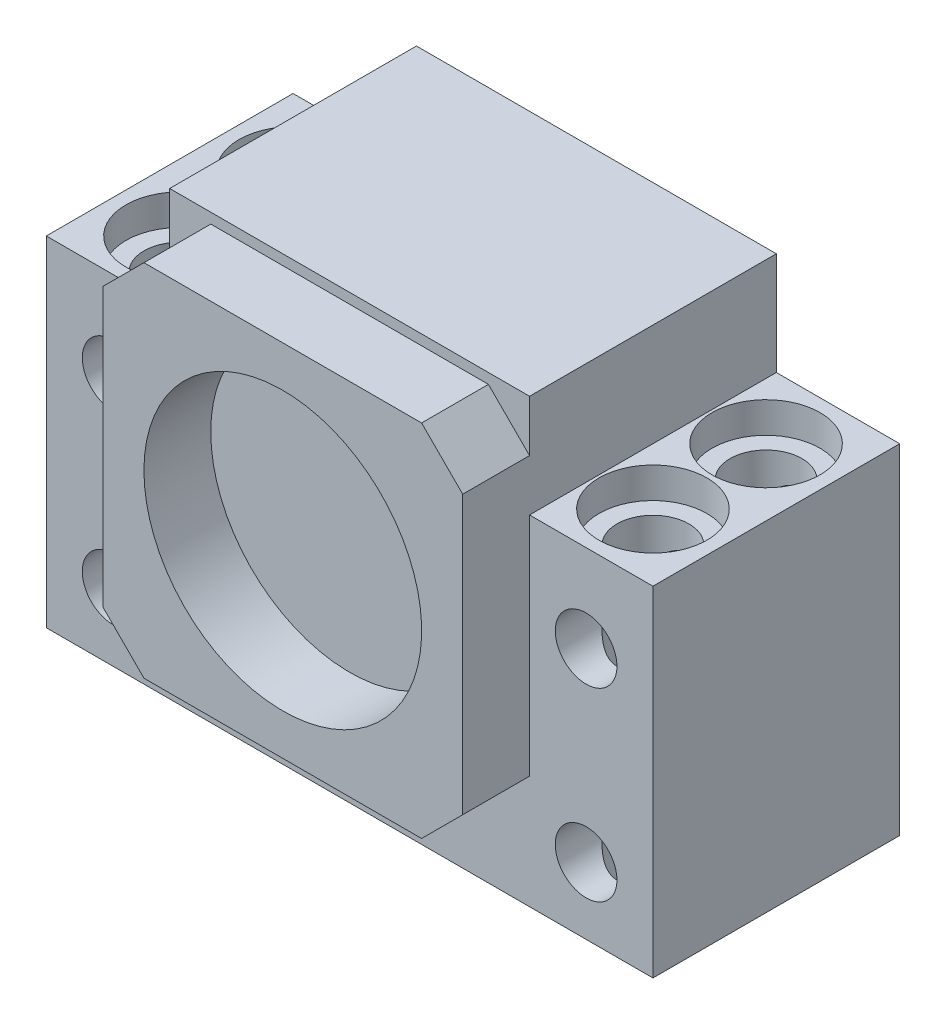
from build123d import *

# Parameters (mm, degrees)
ESQUISSE1_R             = 13.5
ESQUISSE1_R_2           = 3
BOSS_EXTRU_1_DEPTH      = 24
ENL_V_MAT_EXTRU_1_REACH = 52.351
ESQUISSE2_R             = 3.5
ESQUISSE3_R             = 5.25
ENL_V_MAT_EXTRU_2_DEPTH = 3
ESQUISSE5_R             = 13.505970571
BOSS_EXTRU_2_DEPTH      = 6.5


with BuildPart() as part:
    # Esquisse1 → Boss.-Extru.1 (new body)
    with BuildSketch(Plane.XY):
        Polygon((-17.5, 18.5), (17.5, 18.5), (17.5, 8.5), (29.5, 8.5), (29.5, -24.5), (-29.5, -24.5), (-29.5, 8.5), (-17.5, 8.5), align=None)
        Circle(ESQUISSE1_R, mode=Mode.SUBTRACT)
        with Locations((-23, -18)):
            Circle(ESQUISSE1_R_2, mode=Mode.SUBTRACT)
        with Locations((-23, 0)):
            Circle(ESQUISSE1_R_2, mode=Mode.SUBTRACT)
        with Locations((23, 0)):
            Circle(ESQUISSE1_R_2, mode=Mode.SUBTRACT)
        with Locations((23, -18)):
            Circle(ESQUISSE1_R_2, mode=Mode.SUBTRACT)
    extrude(amount=BOSS_EXTRU_1_DEPTH)

    # Enlèv. mat.-Extru.1: up to this face of the body (flat: up to its plane)
    enl_v_mat_extru_1_end = Plane(part.part.faces().sort_by_distance((0, -24.5, 12))[0])
    # Esquisse2 → Enlèv. mat.-Extru.1 (cut, up to the picked face)
    with BuildSketch(Plane(origin=(0, 8.5, 0), x_dir=(1, 0, 0), z_dir=(0, 1, 0)), mode=Mode.PRIVATE) as enl_v_mat_extru_1_sk1:
        with Locations(Location((-23, -17.5, 0), (0, 0, 180))):
            Circle(ESQUISSE2_R)
    enl_v_mat_extru_1_tool1 = split(extrude(enl_v_mat_extru_1_sk1.sketch, amount=-ENL_V_MAT_EXTRU_1_REACH, mode=Mode.PRIVATE), bisect_by=enl_v_mat_extru_1_end, keep=Keep.BOTH, mode=Mode.PRIVATE)
    # Esquisse2 → Enlèv. mat.-Extru.1 (cut, up to the picked face)
    with BuildSketch(Plane(origin=(0, 8.5, 0), x_dir=(1, 0, 0), z_dir=(0, 1, 0)), mode=Mode.PRIVATE) as enl_v_mat_extru_1_sk2:
        with Locations(Location((23, -17.5, 0), (0, 0, 180))):
            Circle(ESQUISSE2_R)
    enl_v_mat_extru_1_tool2 = split(extrude(enl_v_mat_extru_1_sk2.sketch, amount=-ENL_V_MAT_EXTRU_1_REACH, mode=Mode.PRIVATE), bisect_by=enl_v_mat_extru_1_end, keep=Keep.BOTH, mode=Mode.PRIVATE)
    # Esquisse2 → Enlèv. mat.-Extru.1 (cut, up to the picked face)
    with BuildSketch(Plane(origin=(0, 8.5, 0), x_dir=(1, 0, 0), z_dir=(0, 1, 0)), mode=Mode.PRIVATE) as enl_v_mat_extru_1_sk3:
        with Locations(Location((23, -6.5, 0), (0, 0, 180))):
            Circle(ESQUISSE2_R)
    enl_v_mat_extru_1_tool3 = split(extrude(enl_v_mat_extru_1_sk3.sketch, amount=-ENL_V_MAT_EXTRU_1_REACH, mode=Mode.PRIVATE), bisect_by=enl_v_mat_extru_1_end, keep=Keep.BOTH, mode=Mode.PRIVATE)
    # Esquisse2 → Enlèv. mat.-Extru.1 (cut, up to the picked face)
    with BuildSketch(Plane(origin=(0, 8.5, 0), x_dir=(1, 0, 0), z_dir=(0, 1, 0)), mode=Mode.PRIVATE) as enl_v_mat_extru_1_sk4:
        with Locations(Location((-23, -6.5, 0), (0, 0, 180))):
            Circle(ESQUISSE2_R)
    enl_v_mat_extru_1_tool4 = split(extrude(enl_v_mat_extru_1_sk4.sketch, amount=-ENL_V_MAT_EXTRU_1_REACH, mode=Mode.PRIVATE), bisect_by=enl_v_mat_extru_1_end, keep=Keep.BOTH, mode=Mode.PRIVATE)
    add(enl_v_mat_extru_1_tool1.solids().sort_by(Axis((-23, 8.5, 17.5), (0, -1, 0)))[0], mode=Mode.SUBTRACT)
    add(enl_v_mat_extru_1_tool2.solids().sort_by(Axis((23, 8.5, 17.5), (0, -1, 0)))[0], mode=Mode.SUBTRACT)
    add(enl_v_mat_extru_1_tool3.solids().sort_by(Axis((23, 8.5, 6.5), (0, -1, 0)))[0], mode=Mode.SUBTRACT)
    add(enl_v_mat_extru_1_tool4.solids().sort_by(Axis((-23, 8.5, 6.5), (0, -1, 0)))[0], mode=Mode.SUBTRACT)

    # Esquisse3 → Enlèv. mat.-Extru.2 (cut)
    with BuildSketch(Plane(origin=(0, 8.5, 0), x_dir=(1, 0, 0), z_dir=(0, 1, 0))):
        with Locations(Location((-23, -17.5, 0), (0, 0, 180))):
            Circle(ESQUISSE3_R)
        with Locations(Location((23, -17.5, 0), (0, 0, 180))):
            Circle(ESQUISSE3_R)
        with Locations(Location((-23, -6.5, 0), (0, 0, 180))):
            Circle(ESQUISSE3_R)
        with Locations(Location((23, -6.5, 0), (0, 0, 180))):
            Circle(ESQUISSE3_R)
    extrude(amount=-ENL_V_MAT_EXTRU_2_DEPTH, mode=Mode.SUBTRACT)

    # Esquisse5 → Boss.-Extru.2 (add)
    with BuildSketch(Plane.XY.offset(24)):
        Polygon((-17.5, 13.5), (-17.5, -13.5), (-13.5, -17.5), (13.5, -17.5), (17.5, -13.5), (17.5, 13.5), (13.5, 17.5), (-13.5, 17.5), align=None)
        with Locations(Location((0, 0, 0), (0, 0, 180))):
            Circle(ESQUISSE5_R, mode=Mode.SUBTRACT)
    extrude(amount=BOSS_EXTRU_2_DEPTH)


solid = part.part
